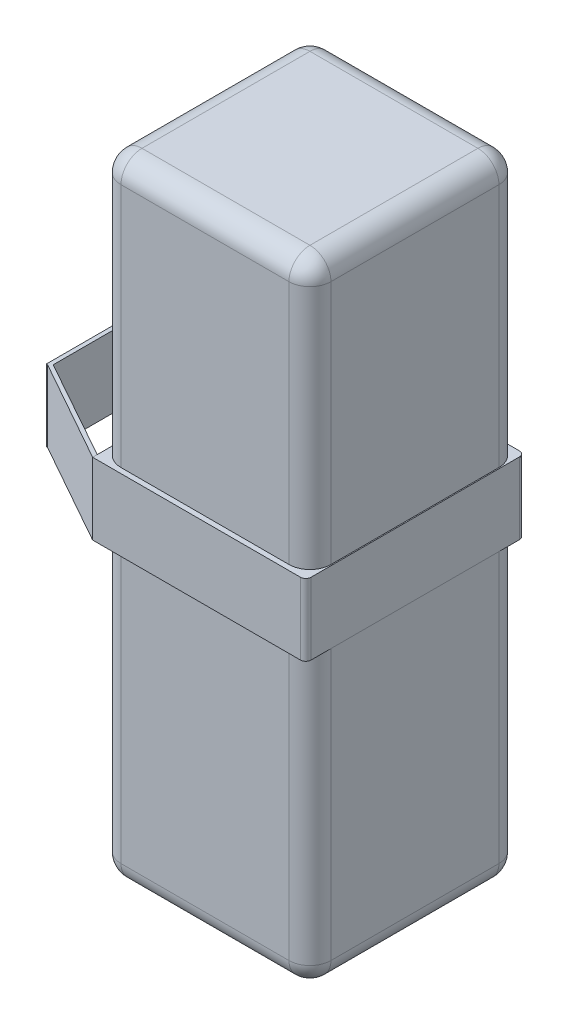
from build123d import *

# Parameters (mm, degrees)
SKETCH_1_W           = 20
SKETCH_1_H           = 60
EXTRUDE_1_DEPTH      = 20
FILLET_1_R           = 2
SKETCH_2_W           = 16
SKETCH_2_H           = 1.155895232
EXTRUDE_2_DEPTH      = 0.5
EXTRUDE_3_DEPTH      = 2.1
EXTRUDE_3_DEPTH_BACK = 18.2
SKETCH_4_W           = 0.476897723
SKETCH_4_H           = 2.004187554
SKETCH_4_W_2         = 0.424555406
EXTRUDE_4_DEPTH      = 0.1
EXTRUDE_5_DEPTH      = 6.83
CUT_EXTRUDE_1_DEPTH  = 6.83
SKETCH_7_W           = 11.171140339
SKETCH_7_H           = 6.83
EXTRUDE_6_DEPTH      = 0.1
FILLET_5_R           = 0.5


with BuildPart() as part:
    # 草图1 → 凸台-拉伸1 (new body)
    with BuildSketch(Plane(origin=(0, 0, 0), x_dir=(0, 0, -1), z_dir=(1, 0, 0))):
        Rectangle(SKETCH_1_W, SKETCH_1_H)
    extrude(amount=EXTRUDE_1_DEPTH)

    # 圆角1
    fillet_1_edges = [part.edges().sort_by_distance(p)[0] for p in [
        (20, 0, 10),
        (20, -30, 0),
        (20, 0, -10),
        (0, -30, 0),
        (0, 0, 10),
        (0, 30, 0),
        (0, 0, -10),
        (10, -30, -10),
        (10, -30, 10),
        (10, 30, 10),
        (10, 30, -10),
        (20, 30, 0),
    ]]
    fillet(fillet_1_edges, radius=FILLET_1_R)

    # 草图2 → 凸台-拉伸2 (add)
    with BuildSketch(Plane.XY.offset(10)):
        with Locations((10, 0.577947616)):
            Rectangle(SKETCH_2_W, SKETCH_2_H)
    extrude(amount=EXTRUDE_2_DEPTH)

    # 草图3 → 凸台-拉伸3 (add, two sides: drawn at the far end of the back side and taken through both)
    with BuildSketch(Plane(origin=(18, 0, 0), x_dir=(0, 0, -1), z_dir=(1, 0, 0)).offset(-EXTRUDE_3_DEPTH_BACK)):
        Polygon((-10.5, 1.155895232), (-10.5, 4.667192464), (10.350971517, 4.667192464), (10.350971517, -2.166522321), (-10.5, -2.166522321), align=None)
    extrude(amount=EXTRUDE_3_DEPTH + EXTRUDE_3_DEPTH_BACK)

    # 草图4 → 凸台-拉伸4 (add)
    with BuildSketch(Plane.ZY):
        with Locations((-5.238448862, 5.669286241)):
            Rectangle(SKETCH_4_W, SKETCH_4_H)
        with Locations((5.212277703, 5.669286241)):
            Rectangle(SKETCH_4_W_2, SKETCH_4_H)
    extrude(amount=EXTRUDE_4_DEPTH)

    # 草图5 → 凸台-拉伸5 (add)
    with BuildSketch(Plane.XZ.offset(2.166522321)):
        Polygon((-0.2, -10.350971517), (-0.2, 8), (-4.654545455, 8), (-10, 5), (-10, 0), (-10, -6.171140339), align=None)
        Polygon((-4.654545455, 8), (-0.2, 8), (-0.2, 10.5), align=None)
    extrude(amount=-EXTRUDE_5_DEPTH)

    # 草图6 → 切除-拉伸1 (cut)
    with BuildSketch(Plane.XZ.offset(2.166522321)):
        Polygon((-9.707704369, -5.877282194), (-0.2, -10.073184662), (-0.2, 10.062586421), (-9.707704369, 4.749296883), align=None)
    extrude(amount=-CUT_EXTRUDE_1_DEPTH, mode=Mode.SUBTRACT)

    # 草图7 → 凸台-拉伸6 (add)
    with BuildSketch(Plane.ZY.offset(10)):
        with Locations((-0.58557017, 1.248477679)):
            Rectangle(SKETCH_7_W, SKETCH_7_H)
    extrude(amount=EXTRUDE_6_DEPTH)

    # 圆角5
    fillet_5_edges = [part.edges().sort_by_distance(p)[0] for p in [
        (20.1, 1.250335071, 10.5),
        (20.1, 1.250335071, -10.350971517),
    ]]
    fillet(fillet_5_edges, radius=FILLET_5_R)


solid = part.part
